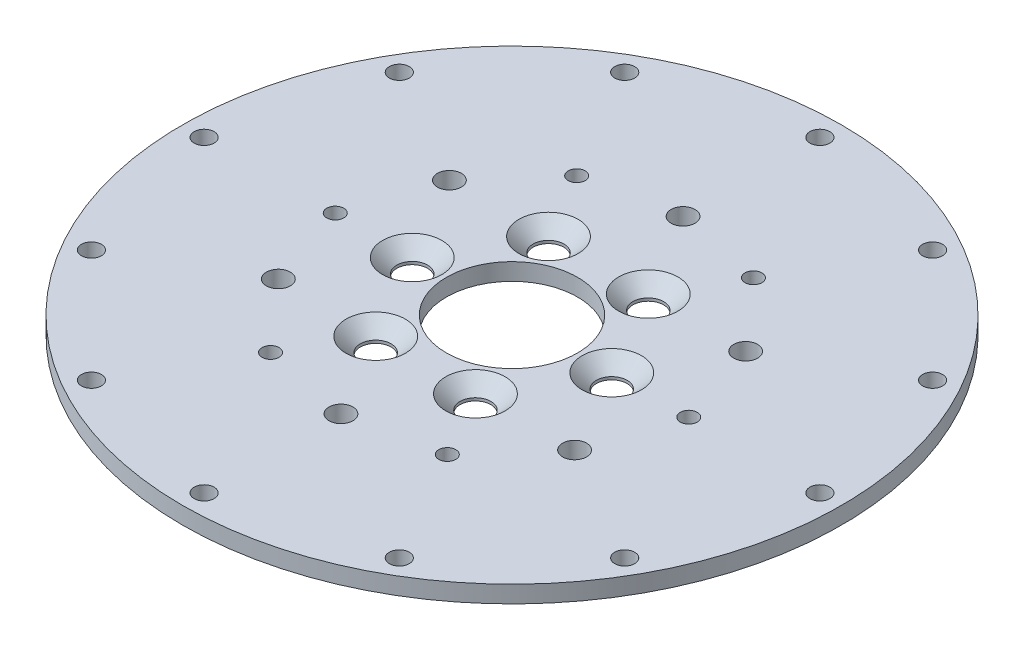
from build123d import *

# Parameters (mm, degrees)
SKETCH_1_R               = 57.8
EXTRUDE_1_DEPTH          = 3
SKETCH_2_R               = 1.75
CUT_EXTRUDE_1_DEPTH      = 82.796576945
PATTERN_CIRCULAR_1_COUNT = 12
SKETCH_3_R               = 2.1
CUT_EXTRUDE_2_DEPTH      = 82.796576945
PATTERN_CIRCULAR_2_COUNT = 6
SKETCH_4_R               = 1.49
CUT_EXTRUDE_3_DEPTH      = 82.796576945
PATTERN_CIRCULAR_3_COUNT = 6
SKETCH_5_R               = 2.7
SKETCH_5_R_2             = 11.5
CUT_EXTRUDE_4_DEPTH      = 82.796576945
PATTERN_CIRCULAR_4_COUNT = 6
CHAMFER_1_SIZE           = 2.5


with BuildPart() as part:
    # 草图1 → 凸台-拉伸1 (new body)
    with BuildSketch(Plane(origin=(0, 0, 0), x_dir=(1, 0, 0), z_dir=(0, 1, 0))):
        with Locations(Location((0, 0, 0), (0, 0, 270))):
            Circle(SKETCH_1_R)
    extrude(amount=EXTRUDE_1_DEPTH)

    # 草图2 → 切除-拉伸1 (cut, symmetric)
    with BuildSketch(Plane.XZ):
        with Locations(Location((0, 54, 0), (0, 0, 270))):
            Circle(SKETCH_2_R)
    cut_extrude_1 = extrude(amount=CUT_EXTRUDE_1_DEPTH, both=True, mode=Mode.SUBTRACT)

    # 阵列(圆周)1: 切除-拉伸1 ×12 about axis
    pattern_circular_1_axis = Axis((0, 0, 0), (0, 1, 0))
    for i in range(1, PATTERN_CIRCULAR_1_COUNT):
        add(cut_extrude_1.rotate(pattern_circular_1_axis, i * 360 / PATTERN_CIRCULAR_1_COUNT), mode=Mode.SUBTRACT)

    # 草图3 → 切除-拉伸2 (cut, symmetric)
    with BuildSketch(Plane.XZ):
        with Locations(Location((0, 30, 0), (0, 0, 270))):
            Circle(SKETCH_3_R)
    cut_extrude_2 = extrude(amount=CUT_EXTRUDE_2_DEPTH, both=True, mode=Mode.SUBTRACT)

    # 阵列(圆周)2: 切除-拉伸2 ×6 about axis
    pattern_circular_2_axis = Axis((0, 0, 0), (0, 1, 0))
    for i in range(1, PATTERN_CIRCULAR_2_COUNT):
        add(cut_extrude_2.rotate(pattern_circular_2_axis, i * 360 / PATTERN_CIRCULAR_2_COUNT), mode=Mode.SUBTRACT)

    # 草图4 → 切除-拉伸3 (cut, symmetric)
    with BuildSketch(Plane.XZ):
        with Locations(Location((31, 0, 0), (0, 0, 270))):
            Circle(SKETCH_4_R)
    cut_extrude_3 = extrude(amount=CUT_EXTRUDE_3_DEPTH, both=True, mode=Mode.SUBTRACT)

    # 阵列(圆周)3: 切除-拉伸3 ×6 about axis
    pattern_circular_3_axis = Axis((0, 0, 0), (0, 1, 0))
    for i in range(1, PATTERN_CIRCULAR_3_COUNT):
        add(cut_extrude_3.rotate(pattern_circular_3_axis, i * 360 / PATTERN_CIRCULAR_3_COUNT), mode=Mode.SUBTRACT)

    # 草图5 → 切除-拉伸4 (cut, symmetric)
    with BuildSketch(Plane(origin=(0, 3, 0), x_dir=(1, 0, 0), z_dir=(0, 1, 0))):
        with Locations(Location((17.5, 0, 0), (0, 0, 270))):
            Circle(SKETCH_5_R)
        with Locations(Location((0, 0, 0), (0, 0, 270))):
            Circle(SKETCH_5_R_2)
    cut_extrude_4 = extrude(amount=CUT_EXTRUDE_4_DEPTH, both=True, mode=Mode.SUBTRACT)

    # 阵列(圆周)4: 切除-拉伸4 ×6 about axis
    pattern_circular_4_axis = Axis((0, 0, 0), (0, 1, 0))
    for i in range(1, PATTERN_CIRCULAR_4_COUNT):
        add(cut_extrude_4.rotate(pattern_circular_4_axis, i * 360 / PATTERN_CIRCULAR_4_COUNT), mode=Mode.SUBTRACT)

    # 倒角1
    chamfer_1_edges = [part.edges().sort_by_distance(p)[0] for p in [
        (17.5, 3, -2.7),
        (-11.08826859, 3, -13.805444566),
        (6.41173141, 3, -16.505444566),
        (-6.41173141, 3, 16.505444566),
        (-17.5, 3, 2.7),
        (11.08826859, 3, 13.805444566),
    ]]
    chamfer(chamfer_1_edges, length=CHAMFER_1_SIZE)


solid = part.part
